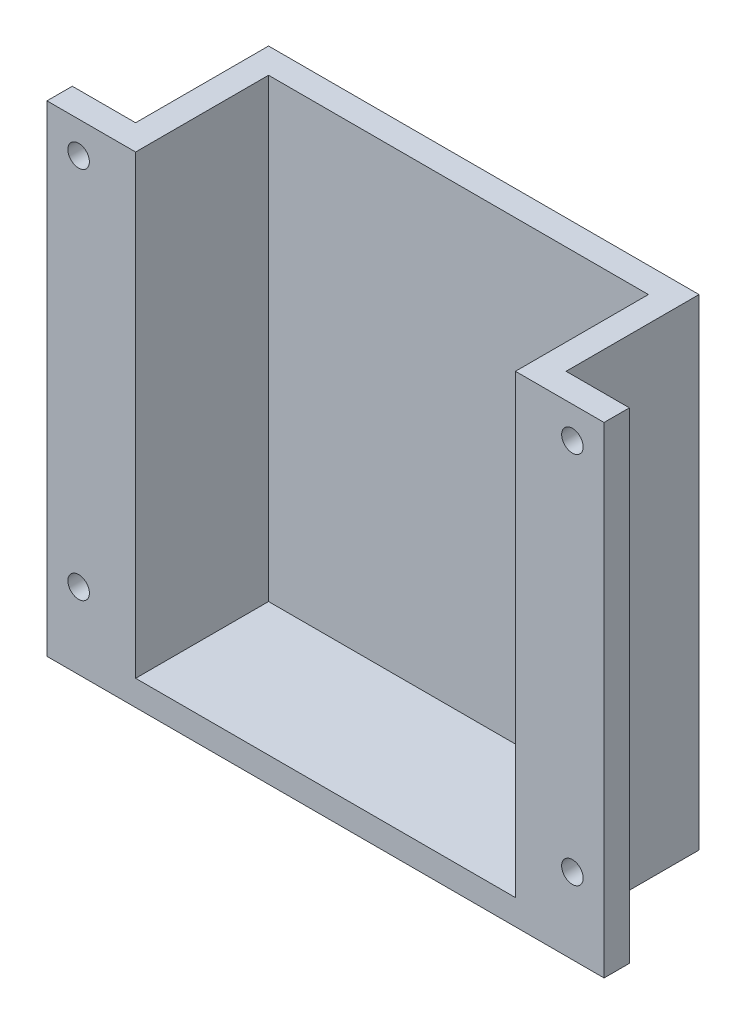
from build123d import *

# Parameters (mm, degrees)
BOSS_EXTRUDE1_DEPTH = 76
SKETCH2_W           = 60
SKETCH2_H           = 4
EXTRUDE_THIN1_DEPTH = 21
SKETCH4_R           = 1.7
CUT_EXTRUDE1_DEPTH  = 21


with BuildPart() as part:
    # Sketch1 → Boss-Extrude1 (new body)
    with BuildSketch(Plane(origin=(0, 0, 0), x_dir=(1, 0, 0), z_dir=(0, 1, 0))):
        Polygon((-48.166666667, 0), (-38.166666667, 0), (-38.166666667, 21), (29.833333333, 21), (29.833333333, 0), (39.833333333, 0), (39.833333333, -4), (25.833333333, -4), (25.833333333, 17), (-34.166666667, 17), (-34.166666667, -4), (-48.166666667, -4), align=None)
    extrude(amount=BOSS_EXTRUDE1_DEPTH)

    # Sketch2 → Extrude-Thin1 (add)
    with BuildSketch(Plane.XY.offset(-17)):
        with Locations((-4.166666667, 2)):
            Rectangle(SKETCH2_W, SKETCH2_H)
    extrude(amount=EXTRUDE_THIN1_DEPTH)

    # Sketch4 → Cut-Extrude1 (cut)
    with BuildSketch(Plane(origin=(0, 0, 0), x_dir=(-1, 0, 0), z_dir=(0, 0, -1))):
        with Locations((-34.833333333, 71)):
            Circle(SKETCH4_R)
        with Locations((-34.833333333, 12)):
            Circle(SKETCH4_R)
        with Locations((43.166666667, 71)):
            Circle(SKETCH4_R)
        with Locations((43.166666667, 12)):
            Circle(SKETCH4_R)
    extrude(amount=-CUT_EXTRUDE1_DEPTH, mode=Mode.SUBTRACT)


solid = part.part
